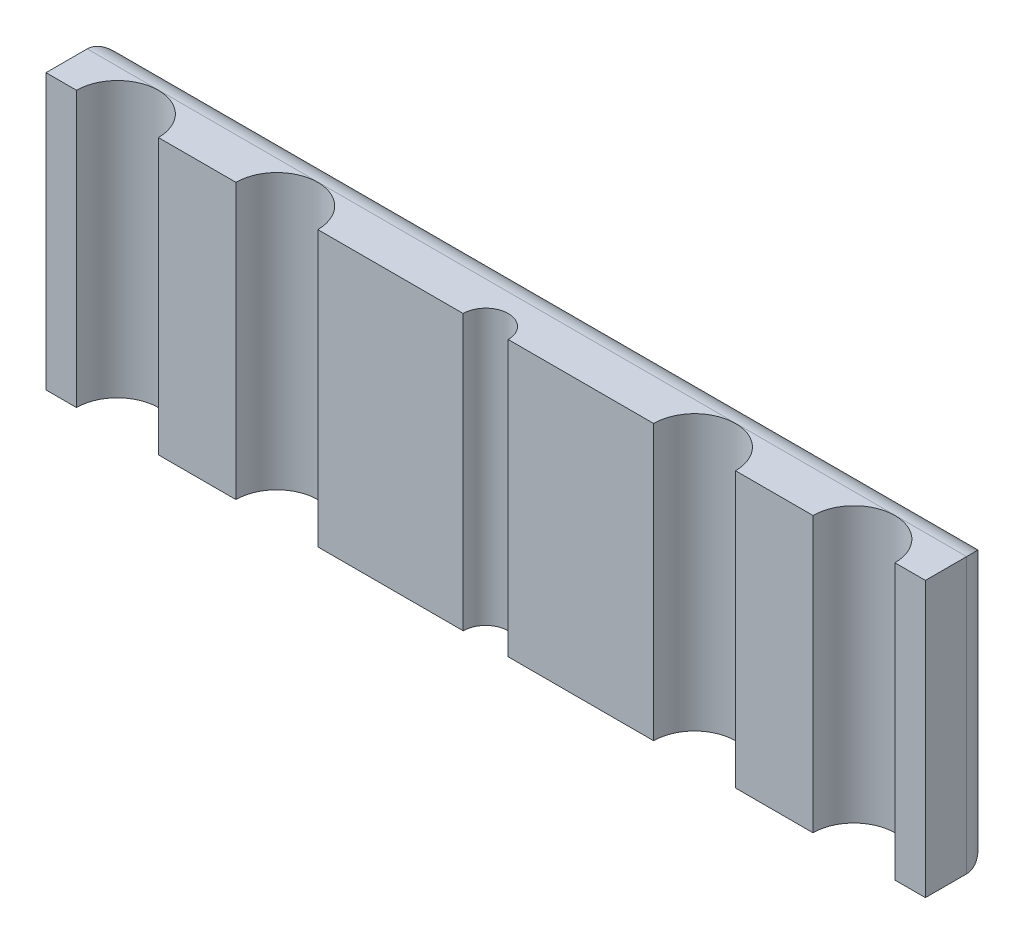
from build123d import *

# Parameters (mm, degrees)
ESQUISSE1_W             = 160
ESQUISSE1_H             = 50
BOSS_EXTRU_1_DEPTH      = 12.5
ESQUISSE2_R             = 7.45
ESQUISSE2_R_2           = 4.1
ENL_V_MAT_EXTRU_1_DEPTH = 169.09595474
CONG_1_R                = 5


with BuildPart() as part:
    # Esquisse1 → Boss.-Extru.1 (new body)
    with BuildSketch(Plane.XY):
        with Locations((-80, -25)):
            Rectangle(ESQUISSE1_W, ESQUISSE1_H)
    extrude(amount=BOSS_EXTRU_1_DEPTH)

    # Esquisse2 → Enlèv. mat.-Extru.1 (cut, through all)
    with BuildSketch(Plane(origin=(0, 0, 0), x_dir=(1, 0, 0), z_dir=(0, 1, 0))):
        with Locations((-147, -12.5)):
            Circle(ESQUISSE2_R)
        with Locations((-118, -12.5)):
            Circle(ESQUISSE2_R)
        with Locations((-13, -12.5)):
            Circle(ESQUISSE2_R)
        with Locations((-42, -12.5)):
            Circle(ESQUISSE2_R)
        with Locations((-80, -12.5)):
            Circle(ESQUISSE2_R_2)
    extrude(amount=-ENL_V_MAT_EXTRU_1_DEPTH, mode=Mode.SUBTRACT)

    # Congé1
    cong_1_edges = [part.edges().sort_by_distance(p)[0] for p in [
        (-80, -50, 0),
        (-160, -25, 0),
        (-80, 0, 0),
        (0, -25, 0),
    ]]
    fillet(cong_1_edges, radius=CONG_1_R)


solid = part.part
